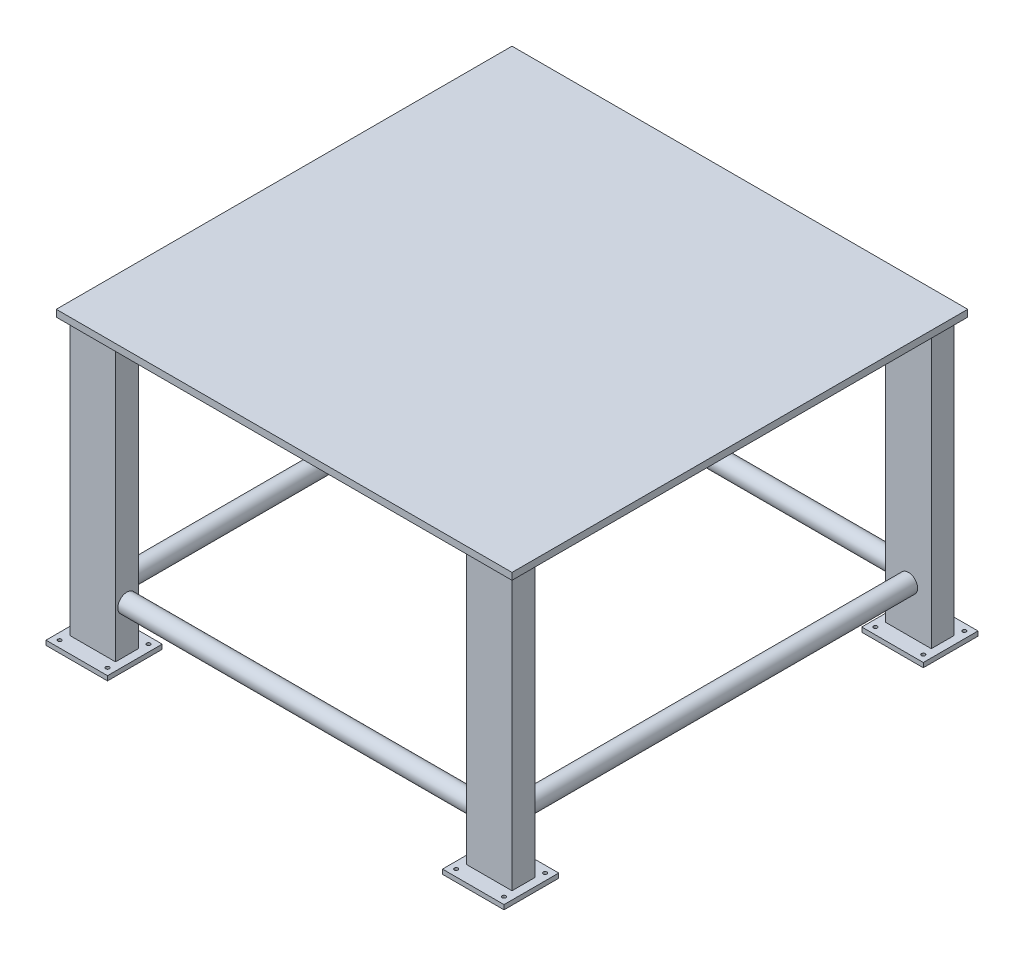
from build123d import *

# Parameters (mm, degrees)
SKETCH1_W               = 1000
SKETCH1_H               = 1000
BOSS_EXTRUDE1_DEPTH     = 15
SKETCH2_W               = 100
SKETCH2_H               = 50
BOSS_EXTRUDE2_DEPTH     = 605
SKETCH3_W               = 135
SKETCH3_H               = 120
BOSS_EXTRUDE3_DEPTH     = 10
SKETCH5_R               = 4
CUT_EXTRUDE1_DEPTH      = 10
MIRROR2_COPY_1_SKETCH_W = 100
MIRROR2_COPY_1_SKETCH_H = 50
MIRROR2_COPY_1_DEPTH    = 605
MIRROR2_COPY_2_SKETCH_W = 135
MIRROR2_COPY_2_SKETCH_H = 120
MIRROR2_COPY_2_DEPTH    = 10
MIRROR2_COPY_3_SKETCH_R = 4
MIRROR2_COPY_3_DEPTH    = 10
SKETCH6_R               = 20
BOSS_EXTRUDE4_DEPTH     = 870
SKETCH7_R               = 20
BOSS_EXTRUDE5_DEPTH     = 770


with BuildPart() as part:
    # Sketch1 → Boss-Extrude1 (new body)
    with BuildSketch(Plane(origin=(0, 0, 0), x_dir=(1, 0, 0), z_dir=(0, 1, 0))):
        Rectangle(SKETCH1_W, SKETCH1_H)
    extrude(amount=BOSS_EXTRUDE1_DEPTH)

    # Sketch2 → Boss-Extrude2 (add)
    with BuildSketch(Plane.XZ):
        with Locations((435, 460)):
            Rectangle(SKETCH2_W, SKETCH2_H)
    boss_extrude2 = extrude(amount=BOSS_EXTRUDE2_DEPTH)

    # Sketch3 → Boss-Extrude3 (add)
    with BuildSketch(Plane.XZ.offset(605)):
        with Locations((435, 460)):
            Rectangle(SKETCH3_W, SKETCH3_H)
    boss_extrude3 = extrude(amount=BOSS_EXTRUDE3_DEPTH)

    # Sketch5 → Cut-Extrude1 (cut)
    with BuildSketch(Plane.XZ.offset(615)):
        with Locations(Location((382.5, 505, 0), (0, 0, 270))):
            Circle(SKETCH5_R)
        with Locations(Location((382.5, 415, 0), (0, 0, 270))):
            Circle(SKETCH5_R)
        with Locations(Location((487.5, 415, 0), (0, 0, 270))):
            Circle(SKETCH5_R)
        with Locations(Location((487.5, 505, 0), (0, 0, 270))):
            Circle(SKETCH5_R)
    cut_extrude1 = extrude(amount=-CUT_EXTRUDE1_DEPTH, mode=Mode.SUBTRACT)

    # Mirror1: Boss-Extrude2, Boss-Extrude3, Cut-Extrude1 across plane
    add(boss_extrude2.mirror(Plane.XY))
    add(boss_extrude3.mirror(Plane.XY))
    add(cut_extrude1.mirror(Plane.XY), mode=Mode.SUBTRACT)

    # Mirror2: Boss-Extrude2, Boss-Extrude3, Cut-Extrude1 across plane
    add(boss_extrude2.mirror(Plane(origin=(0, 0, 0), x_dir=(0, 0, 1), z_dir=(1, 0, 0))))
    add(boss_extrude3.mirror(Plane(origin=(0, 0, 0), x_dir=(0, 0, 1), z_dir=(1, 0, 0))))
    add(cut_extrude1.mirror(Plane(origin=(0, 0, 0), x_dir=(0, 0, 1), z_dir=(1, 0, 0))), mode=Mode.SUBTRACT)

    # Mirror2 copy 1 sketch → Mirror2 copy 1 (add)
    with BuildSketch(Plane(origin=(0, 0, 0), x_dir=(-1, 0, 0), z_dir=(0, -1, 0))):
        with Locations((435, 460)):
            Rectangle(MIRROR2_COPY_1_SKETCH_W, MIRROR2_COPY_1_SKETCH_H)
    extrude(amount=MIRROR2_COPY_1_DEPTH)

    # Mirror2 copy 2 sketch → Mirror2 copy 2 (add)
    with BuildSketch(Plane(origin=(0, -605, 0), x_dir=(-1, 0, 0), z_dir=(0, -1, 0))):
        with Locations((435, 460)):
            Rectangle(MIRROR2_COPY_2_SKETCH_W, MIRROR2_COPY_2_SKETCH_H)
    extrude(amount=MIRROR2_COPY_2_DEPTH)

    # Mirror2 copy 3 sketch → Mirror2 copy 3 (cut)
    with BuildSketch(Plane(origin=(0, -615, 0), x_dir=(-1, 0, 0), z_dir=(0, -1, 0))):
        with Locations(Location((382.5, 505, 0), (0, 0, 270))):
            Circle(MIRROR2_COPY_3_SKETCH_R)
        with Locations(Location((382.5, 415, 0), (0, 0, 270))):
            Circle(MIRROR2_COPY_3_SKETCH_R)
        with Locations(Location((487.5, 415, 0), (0, 0, 270))):
            Circle(MIRROR2_COPY_3_SKETCH_R)
        with Locations(Location((487.5, 505, 0), (0, 0, 270))):
            Circle(MIRROR2_COPY_3_SKETCH_R)
    extrude(amount=-MIRROR2_COPY_3_DEPTH, mode=Mode.SUBTRACT)

    # Sketch6 → Boss-Extrude4 (add)
    with BuildSketch(Plane(origin=(0, 0, 435), x_dir=(-1, 0, 0), z_dir=(0, 0, -1))):
        with Locations(Location((-435, -505, 0), (0, 0, 180))):
            Circle(SKETCH6_R)
    boss_extrude4 = extrude(amount=BOSS_EXTRUDE4_DEPTH)

    # Sketch7 → Boss-Extrude5 (add)
    with BuildSketch(Plane.ZY.offset(-385)):
        with Locations(Location((460, -505, 0), (0, 0, 180))):
            Circle(SKETCH7_R)
    boss_extrude5 = extrude(amount=BOSS_EXTRUDE5_DEPTH)

    # Mirror3: Boss-Extrude5 across plane
    add(boss_extrude5.mirror(Plane.XY))

    # Mirror4: Boss-Extrude4 across plane
    add(boss_extrude4.mirror(Plane(origin=(0, 0, 0), x_dir=(0, 0, 1), z_dir=(1, 0, 0))))


solid = part.part
